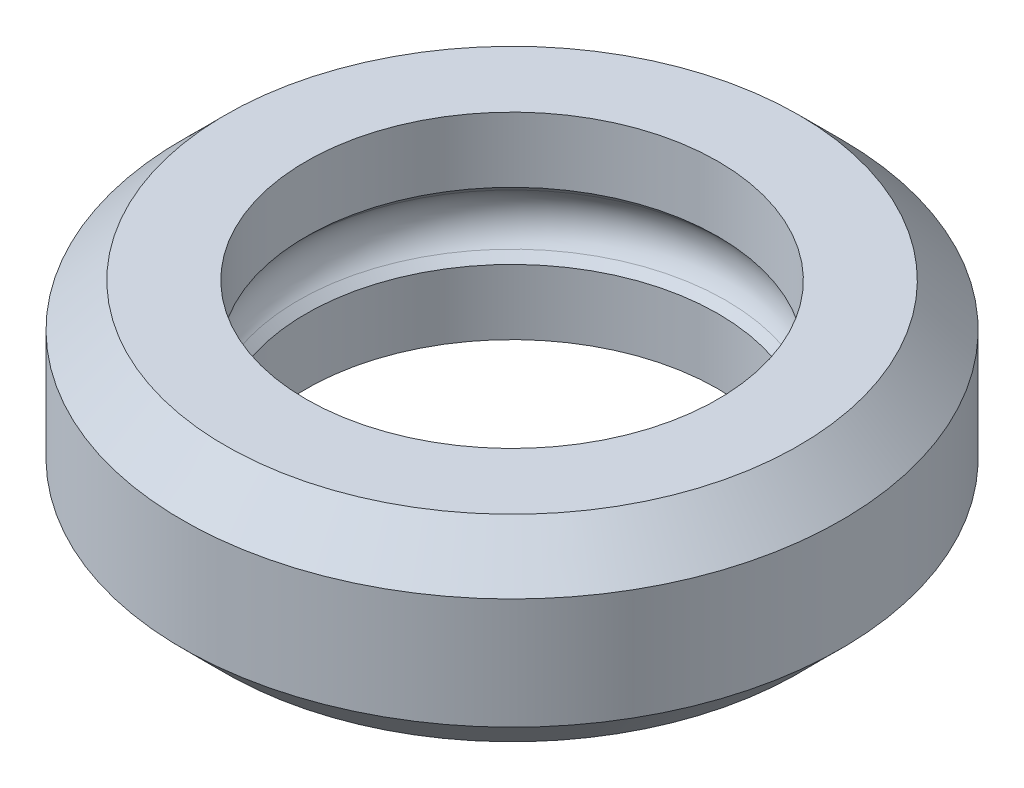
from build123d import *


with BuildPart() as part:
    # Sketch2 → Revolve2 (revolve)
    with BuildSketch(Plane.XY, mode=Mode.PRIVATE) as revolve2_sk:
        with BuildLine():
            ThreePointArc((11.931891232, -1.431891232), (12.525, 0), (11.931891232, 1.431891232))
            Line((11.931891232, 1.431891232), (11.5, 1.863782464))
            Line((11.5, 1.863782464), (11.5, 5.5))
            Line((11.5, 5.5), (16, 5.5))
            Line((16, 5.5), (16, -5.5))
            Line((16, -5.5), (11.5, -5.5))
            Line((11.5, -5.5), (11.5, -1.863782464))
            Line((11.5, -1.863782464), (11.931891232, -1.431891232))
        make_face()
        Polygon((18.4, -3.1), (16, -5.5), (16, 5.5), (18.4, 3.1), align=None)
    revolve(revolve2_sk.sketch.rotate(Axis((0, 0, 0), (0, 1, 0)), 90), axis=Axis((0, 0, 0), (0, 1, 0)))


solid = part.part
